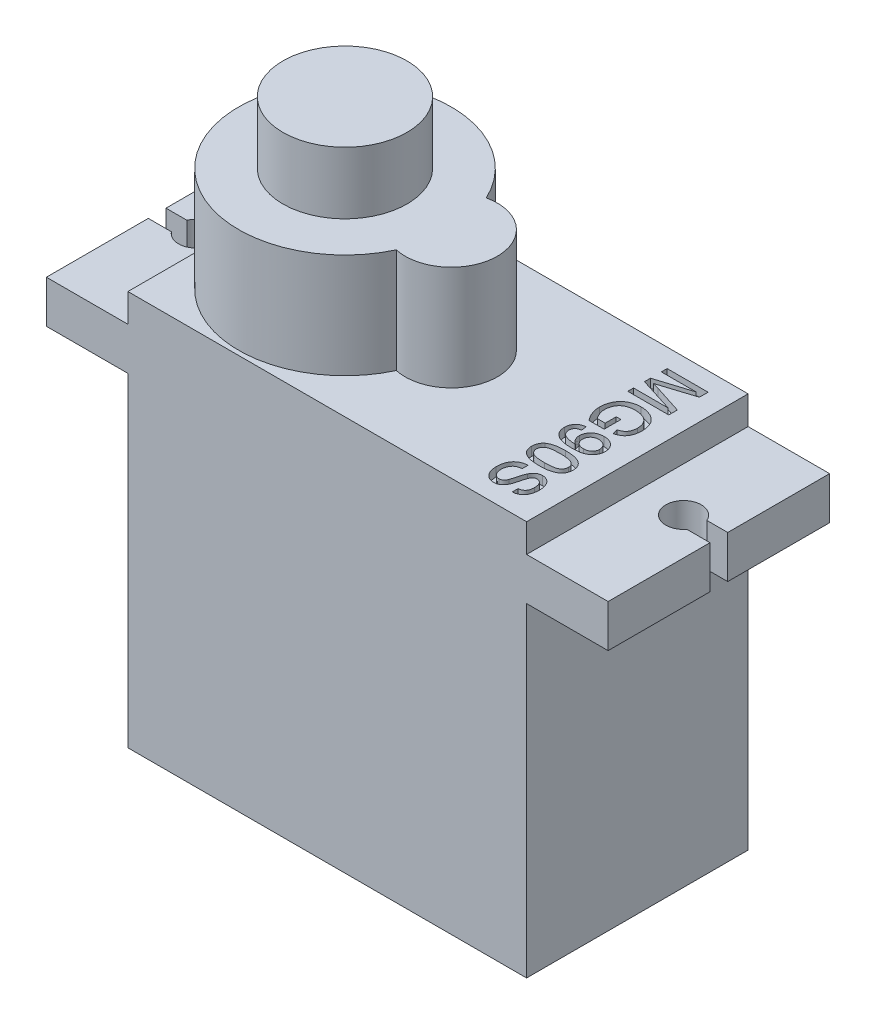
from build123d import *

# Parameters (mm, degrees)
SKETCH_1_W          = 22.5
SKETCH_1_H          = 12.5
EXTRUDE_1_DEPTH     = 22.3
EXTRUDE_2_DEPTH     = 5.9
SKETCH_3_R          = 3.5
EXTRUDE_3_DEPTH     = 3.5
EXTRUDE_4_DEPTH     = 2.4
EXTRUDE_5_DEPTH     = 3
CUT_EXTRUDE_1_DEPTH = 0.5


with BuildPart() as part:
    # 草图1 → 凸台-拉伸1 (new body)
    with BuildSketch(Plane(origin=(0, 0, 0), x_dir=(1, 0, 0), z_dir=(0, 1, 0))):
        with Locations((5.25, 0)):
            Rectangle(SKETCH_1_W, SKETCH_1_H)
    extrude(amount=EXTRUDE_1_DEPTH)

    # 草图2 → 凸台-拉伸2 (add)
    with BuildSketch(Plane(origin=(0, 22.3, 0), x_dir=(1, 0, 0), z_dir=(0, 1, 0))):
        with BuildLine():
            ThreePointArc((5.436666667, -2.538238672), (8.6, 0), (5.436666667, 2.538238672))
            ThreePointArc((5.436666667, 2.538238672), (-6, 0), (5.436666667, -2.538238672))
        make_face()
    extrude(amount=EXTRUDE_2_DEPTH)

    # 草图3 → 凸台-拉伸3 (add)
    with BuildSketch(Plane(origin=(0, 28.2, 0), x_dir=(1, 0, 0), z_dir=(0, 1, 0))):
        Circle(SKETCH_3_R)
    extrude(amount=EXTRUDE_3_DEPTH)

    # 草图4 → 凸台-拉伸4 (add)
    with BuildSketch(Plane(origin=(0, 20.7, 0), x_dir=(1, 0, 0), z_dir=(0, 1, 0))):
        with BuildLine():
            Line((16.5, 6.25), (16.5, -6.25))
            Line((16.5, -6.25), (21.1, -6.25))
            Line((21.1, -6.25), (21.1, -0.5))
            Line((21.1, -0.5), (19.793874497, -0.5))
            ThreePointArc((19.793874497, -0.5), (18.007860167, 0.233215776), (19.92, 0.5))
            Line((19.92, 0.5), (21.1, 0.5))
            Line((21.1, 0.5), (21.1, 6.25))
            Line((21.1, 6.25), (16.5, 6.25))
        make_face()
    extrude_4 = extrude(amount=-EXTRUDE_4_DEPTH)

    # 镜向1: 凸台-拉伸4 across plane
    add(extrude_4.mirror(Plane(origin=(5.25, 0, 0), x_dir=(0, 0, 1), z_dir=(1, 0, 0))))

    # 草图5 → 凸台-拉伸5 (add)
    with BuildSketch(Plane.ZY.offset(6)):
        with BuildLine():
            Line((-0.95, 5.3), (0.95, 5.3))
            ThreePointArc((0.95, 5.3), (1.55, 4.7), (0.95, 4.1))
            Line((0.95, 4.1), (-0.95, 4.1))
            ThreePointArc((-0.95, 4.1), (-1.55, 4.7), (-0.95, 5.3))
        make_face()
    extrude(amount=EXTRUDE_5_DEPTH)

    # 草图6 → 切除-拉伸1 (cut)
    # profile 1 of 5: a face of its own
    with BuildSketch(Plane(origin=(0, 22.3, 0), x_dir=(1, 0, 0), z_dir=(0, 1, 0))):
        with BuildLine():
            Line((12.98065719, 5.200845337), (15.292144006, 5.200845337))
            Line((15.292144006, 5.200845337), (15.292144006, 4.710487857))
            Line((15.292144006, 4.710487857), (13.670121106, 4.193737199))
            add(Edge.make_bspline(
                [(13.670121106, 4.193737199), (13.651746413, 4.188050336), (13.616210827, 4.177052274), (13.564894171, 4.160743453), (13.517206842, 4.14590516), (13.472997048, 4.13254094), (13.43248429, 4.119928954), (13.39533613, 4.109008961), (13.361965366, 4.098569092), (13.340757155, 4.092450863), (13.330714087, 4.089553598)],
                knots=[0, 0, 0, 0, 1.300204174, 2.514519184, 3.639827924, 4.676153899, 5.636536826, 6.507959918, 7.293450077, 8, 8, 8, 8], degree=3))
            add(Edge.make_bspline(
                [(13.330714087, 4.089553598), (13.341676974, 4.086326718), (13.365006699, 4.079459712), (13.401688691, 4.068327197), (13.442281443, 4.056481884), (13.486087232, 4.042306675), (13.533793233, 4.027530697), (13.585359828, 4.012021385), (13.640272186, 3.994131696), (13.678288855, 3.982243104), (13.697903399, 3.976109233)],
                knots=[0, 0, 0, 0, 0.713638162, 1.518667645, 2.393860736, 3.354087503, 4.393659122, 5.512594909, 6.716633584, 8, 8, 8, 8], degree=3))
            Line((13.697903399, 3.976109233), (15.292144006, 3.464451995))
            Line((15.292144006, 3.464451995), (15.292144006, 2.97826186))
            Line((15.292144006, 2.97826186), (12.98065719, 2.97826186))
            Line((12.98065719, 2.97826186), (12.98065719, 3.30424077))
            Line((12.98065719, 3.30424077), (14.93653065, 3.30424077))
            Line((14.93653065, 3.30424077), (12.98065719, 3.921007685))
            Line((12.98065719, 3.921007685), (12.98065719, 4.261803818))
            Line((12.98065719, 4.261803818), (14.93653065, 4.874866427))
            Line((14.93653065, 4.874866427), (12.98065719, 4.874866427))
            Line((12.98065719, 4.874866427), (12.98065719, 5.200845337))
        make_face()
    # profile 2 of 5: a face of its own
    with BuildSketch(Plane(origin=(0, 22.3, 0), x_dir=(1, 0, 0), z_dir=(0, 1, 0))):
        with BuildLine():
            Line((13.899325027, 1.407636202), (14.166035044, 1.407636202))
            Line((14.166035044, 1.407636202), (14.166035044, 0.459333919))
            Line((14.166035044, 0.459333919), (13.310803444, 0.459333919))
            add(Edge.make_bspline(
                [(13.310803444, 0.459333919), (13.282308288, 0.496749863), (13.226226287, 0.570389084), (13.1530637, 0.68586653), (13.091169318, 0.803153126), (13.039734731, 0.921850938), (13.000243456, 1.042812334), (12.972073135, 1.165376409), (12.954086368, 1.289491289), (12.952044853, 1.372848141), (12.951022743, 1.414581776)],
                knots=[0, 0, 0, 0, 1.084304515, 2.13404583, 3.148352623, 4.140192615, 5.113911073, 6.078424675, 7.037939656, 8, 8, 8, 8], degree=3))
            add(Edge.make_bspline(
                [(12.951022743, 1.414581776), (12.951451743, 1.44253427), (12.952303967, 1.498062871), (12.959597773, 1.580275232), (12.97042817, 1.66057008), (12.98637981, 1.738785068), (13.006558012, 1.81509181), (13.031818959, 1.889355259), (13.060963192, 1.961805462), (13.094487732, 2.032073127), (13.13307654, 2.098998186), (13.174906802, 2.162678244), (13.221548864, 2.221687218), (13.271952524, 2.276409681), (13.326647042, 2.326648934), (13.384865782, 2.373176359), (13.447686718, 2.414734918), (13.513949538, 2.452251802), (13.583160827, 2.485357128), (13.65470255, 2.514345394), (13.728543378, 2.53801079), (13.803904729, 2.558904612), (13.881541473, 2.573788254), (13.960941401, 2.585124231), (14.042451231, 2.591571375), (14.097494767, 2.592530015), (14.12528768, 2.593014057)],
                knots=[0, 0, 0, 0, 1.072785209, 2.131125078, 3.165919489, 4.18145346, 5.19319543, 6.193685685, 7.190467576, 8.189500733, 9.179374003, 10.153807477, 11.111508507, 12.063253261, 13.006625817, 13.959678989, 14.920965282, 15.894678021, 16.880464779, 17.86404133, 18.855172685, 19.855469953, 20.864032331, 21.887090983, 22.933137249, 24, 24, 24, 24], degree=3))
            add(Edge.make_bspline(
                [(14.12528768, 2.593014057), (14.152927052, 2.592532653), (14.207817779, 2.591576604), (14.289617686, 2.585016495), (14.369967584, 2.573845953), (14.44903455, 2.55869657), (14.526402048, 2.538566889), (14.602575856, 2.514636418), (14.677125996, 2.485703098), (14.750073903, 2.453083991), (14.820060257, 2.416501846), (14.885807322, 2.375439465), (14.946963081, 2.330737322), (15.003178339, 2.281645362), (15.055423239, 2.229498994), (15.102148366, 2.172635607), (15.144462351, 2.112289334), (15.181970348, 2.048271849), (15.214700717, 1.980940181), (15.243527387, 1.911103104), (15.267447929, 1.838600676), (15.287629303, 1.76384885), (15.302624365, 1.686433312), (15.313904306, 1.606553632), (15.320347074, 1.524119548), (15.321297368, 1.468304911), (15.321778452, 1.440048878)],
                knots=[0, 0, 0, 0, 1.060071961, 2.105262061, 3.145073557, 4.17023897, 5.191105187, 6.20959997, 7.230929519, 8.256368373, 9.273210202, 10.257139963, 11.226862678, 12.175263777, 13.117120328, 14.054725526, 14.994123112, 15.941396515, 16.897159372, 17.863479033, 18.836934967, 19.823443608, 20.831180499, 21.85926455, 22.916257547, 24, 24, 24, 24], degree=3))
            add(Edge.make_bspline(
                [(15.321778452, 1.440048878), (15.320777562, 1.399415571), (15.318814559, 1.319723214), (15.304094315, 1.203158328), (15.27828018, 1.092720426), (15.243738642, 0.988810795), (15.199233986, 0.893666773), (15.147688515, 0.80765329), (15.086316611, 0.733632035), (15.01725295, 0.66930728), (14.93814756, 0.614984794), (14.848879086, 0.568408008), (14.749058465, 0.527835908), (14.677614026, 0.507713982), (14.640649224, 0.497303053)],
                knots=[0, 0, 0, 0, 1.150676663, 2.256772653, 3.320320098, 4.358473249, 5.351958892, 6.289850531, 7.190417357, 8.06583901, 8.954691151, 9.89917112, 10.913047355, 12, 12, 12, 12], degree=3))
            Line((14.640649224, 0.497303053), (14.565637032, 0.79549967))
            add(Edge.make_bspline(
                [(14.565637032, 0.79549967), (14.593076659, 0.804091627), (14.645629662, 0.820547141), (14.718889664, 0.849746665), (14.782573489, 0.882896399), (14.83821226, 0.919198801), (14.886449676, 0.962229198), (14.928495721, 1.01264413), (14.965924735, 1.070752427), (14.997342274, 1.136348225), (15.023308409, 1.207777431), (15.04155356, 1.283893589), (15.05308269, 1.363758259), (15.054397205, 1.418245535), (15.055068435, 1.446068375)],
                knots=[0, 0, 0, 0, 1.164623905, 2.230514369, 3.189783183, 4.069010262, 4.914877457, 5.797920336, 6.720606112, 7.707754307, 8.738229757, 9.793726076, 10.873410273, 12, 12, 12, 12], degree=3))
            add(Edge.make_bspline(
                [(15.055068435, 1.446068375), (15.054234402, 1.478976602), (15.052619613, 1.542690966), (15.041184182, 1.634890578), (15.021388159, 1.720141847), (14.99351882, 1.798298792), (14.958939666, 1.869117281), (14.920329636, 1.933727749), (14.875624551, 1.990475982), (14.826042739, 2.03982059), (14.772973173, 2.082718942), (14.717663333, 2.120976508), (14.659657967, 2.154245416), (14.61891006, 2.172015039), (14.598512746, 2.180910037)],
                knots=[0, 0, 0, 0, 1.282165913, 2.482430477, 3.613002584, 4.685891271, 5.708038531, 6.679660972, 7.613314633, 8.514881922, 9.39970426, 10.268853837, 11.133434455, 12, 12, 12, 12], degree=3))
            add(Edge.make_bspline(
                [(14.598512746, 2.180910037), (14.562623972, 2.194131154), (14.490352322, 2.220755411), (14.376736152, 2.247818181), (14.258481573, 2.263706387), (14.178123671, 2.26591424), (14.137326674, 2.267035147)],
                knots=[0, 0, 0, 0, 0.971838637, 1.957057173, 2.962815955, 4, 4, 4, 4], degree=3))
            add(Edge.make_bspline(
                [(14.137326674, 2.267035147), (14.112310396, 2.266875972), (14.063302703, 2.266564145), (13.991347982, 2.260953577), (13.922313653, 2.253647818), (13.856579706, 2.241676813), (13.793760485, 2.227802818), (13.73443602, 2.209287049), (13.677675361, 2.188895957), (13.624493524, 2.164095763), (13.574345703, 2.136784378), (13.527316825, 2.106832646), (13.484190394, 2.073215858), (13.44406056, 2.036881378), (13.407061372, 1.99767421), (13.373567994, 1.955395975), (13.343818889, 1.90998775), (13.308337644, 1.846333902), (13.272648029, 1.762505799), (13.240523838, 1.658661839), (13.221644335, 1.551245094), (13.21904391, 1.478552874), (13.21773276, 1.441901031)],
                knots=[0, 0, 0, 0, 1.07090929, 2.097945639, 3.089137996, 4.042109723, 4.957603585, 5.842006935, 6.701460028, 7.538380432, 8.351768609, 9.145614463, 9.922973058, 10.69034897, 11.461841051, 12.228789892, 12.996877062, 13.783925265, 15.346951304, 16.887853154, 18.430837314, 20, 20, 20, 20], degree=3))
            add(Edge.make_bspline(
                [(13.21773276, 1.441901031), (13.218787535, 1.409747351), (13.220892221, 1.345588186), (13.235617503, 1.249934896), (13.260362787, 1.155733742), (13.29391381, 1.064798693), (13.332617563, 0.980031071), (13.373711249, 0.904859069), (13.414861505, 0.839507655), (13.446358148, 0.802743094), (13.461290866, 0.785312829)],
                knots=[0, 0, 0, 0, 1.080743358, 2.156505587, 3.245104578, 4.349795648, 5.410880174, 6.374485899, 7.229335469, 8, 8, 8, 8], degree=3))
            Line((13.461290866, 0.785312829), (13.899325027, 0.785312829))
            Line((13.899325027, 0.785312829), (13.899325027, 1.407636202))
        make_face()
    # profile 3 of 5: a face of its own
    with BuildSketch(Plane(origin=(0, 22.3, 0), x_dir=(1, 0, 0), z_dir=(0, 1, 0))):
        with BuildLine():
            Line((13.54371167, 0.074086116), (13.573346117, -0.222258348))
            add(Edge.make_bspline(
                [(13.573346117, -0.222258348), (13.558162593, -0.224937479), (13.528811553, -0.230116466), (13.486981292, -0.241803807), (13.447978625, -0.253657638), (13.412672436, -0.268959337), (13.380103714, -0.284894941), (13.350598822, -0.302941575), (13.324750356, -0.32342077), (13.294460561, -0.352340083), (13.262852645, -0.393372377), (13.237249002, -0.450248697), (13.220033865, -0.512817992), (13.218517328, -0.556912116), (13.21773276, -0.579723857)],
                knots=[0, 0, 0, 0, 0.994516507, 1.922484754, 2.80151264, 3.623050913, 4.402748861, 5.140924173, 5.850441436, 6.526872911, 7.841975818, 9.161260782, 10.53140107, 12, 12, 12, 12], degree=3))
            add(Edge.make_bspline(
                [(13.21773276, -0.579723857), (13.218453086, -0.599683705), (13.2198708, -0.638967781), (13.230815813, -0.696256356), (13.248508071, -0.750826321), (13.273504098, -0.801782802), (13.304122116, -0.848680603), (13.34105338, -0.889052363), (13.381203221, -0.925071344), (13.428257159, -0.954136337), (13.48173356, -0.97900415), (13.542475727, -1.002693982), (13.611980643, -1.023980784), (13.688367697, -1.044889397), (13.770048499, -1.061542779), (13.854246717, -1.074239485), (13.939777606, -1.081803581), (13.997320053, -1.082631113), (14.0261975, -1.083046407)],
                knots=[0, 0, 0, 0, 0.897578202, 1.76657305, 2.614273066, 3.471505887, 4.31321098, 5.12466348, 5.926910931, 6.732248404, 7.601992158, 8.57824993, 9.663257946, 10.871084486, 12.140451753, 13.411337856, 14.700890224, 16, 16, 16, 16], degree=3))
            add(Edge.make_bspline(
                [(14.0261975, -1.083046407), (14.034069486, -1.082906135), (14.052902752, -1.082570544), (14.071730244, -1.081993274), (14.082688164, -1.081657292)],
                knots=[0, 0, 0, 0, 0.835966126, 2, 2, 2, 2], degree=3))
            add(Edge.make_bspline(
                [(14.082688164, -1.081657292), (14.060994883, -1.067369971), (14.017643276, -1.03881835), (13.959433625, -0.986238399), (13.907991805, -0.926106114), (13.86307256, -0.85962447), (13.826475731, -0.787717016), (13.800031038, -0.711905493), (13.783498493, -0.633069527), (13.781697811, -0.579495793), (13.780787241, -0.552404602)],
                knots=[0, 0, 0, 0, 0.978759816, 1.95594251, 2.946784326, 3.957659885, 4.975752972, 5.981130809, 6.979097274, 8, 8, 8, 8], degree=3))
            add(Edge.make_bspline(
                [(13.780787241, -0.552404602), (13.781371992, -0.529829595), (13.782523084, -0.485390261), (13.792758108, -0.420296053), (13.808096576, -0.357682016), (13.831358389, -0.298170611), (13.859932218, -0.240842751), (13.895505542, -0.186579979), (13.937049223, -0.134625257), (13.985009615, -0.086144919), (14.037686451, -0.04110833), (14.095694089, -0.002788363), (14.157046402, 0.03049314), (14.222747078, 0.057329682), (14.292537015, 0.078244617), (14.366524524, 0.092718418), (14.444370001, 0.102469041), (14.497693763, 0.103297855), (14.524889668, 0.103720562)],
                knots=[0, 0, 0, 0, 0.975605932, 1.920499032, 2.843232031, 3.758037144, 4.677408539, 5.60862402, 6.558243673, 7.549410996, 8.553572665, 9.549515321, 10.549921107, 11.567546087, 12.612813693, 13.695349167, 14.824594087, 16, 16, 16, 16], degree=3))
            add(Edge.make_bspline(
                [(14.524889668, 0.103720562), (14.553006183, 0.103085907), (14.608006963, 0.101844412), (14.688432283, 0.092496342), (14.764597631, 0.076954564), (14.836542331, 0.054532498), (14.904207789, 0.025895777), (14.96781443, -0.009187842), (15.027185973, -0.050361686), (15.081614449, -0.097740544), (15.131182754, -0.149300319), (15.174283086, -0.204901428), (15.210744676, -0.263728907), (15.240545524, -0.325662274), (15.263761254, -0.390864527), (15.280504938, -0.459251018), (15.29033823, -0.530971471), (15.291534865, -0.579847714), (15.292144006, -0.604727921)],
                knots=[0, 0, 0, 0, 1.151853335, 2.253224889, 3.312446237, 4.332583134, 5.335719854, 6.317925586, 7.303870435, 8.290281678, 9.269877867, 10.230009666, 11.167185276, 12.100619225, 13.040777443, 13.997905303, 14.980843721, 16, 16, 16, 16], degree=3))
            add(Edge.make_bspline(
                [(15.292144006, -0.604727921), (15.291778435, -0.62279798), (15.291051803, -0.658715215), (15.285507458, -0.712168346), (15.275503966, -0.764352446), (15.262906496, -0.8156232), (15.245259531, -0.86519296), (15.225247484, -0.914088434), (15.200294822, -0.961367038), (15.172348867, -1.007437951), (15.140754918, -1.051663013), (15.105734075, -1.093145109), (15.06730906, -1.131781291), (15.026270796, -1.168251487), (14.980956734, -1.200749954), (14.933280962, -1.231629633), (14.882139571, -1.259342806), (14.827480804, -1.284618632), (14.768174628, -1.307114173), (14.702911834, -1.325881346), (14.63146597, -1.341968923), (14.553742458, -1.355363439), (14.469796671, -1.365295686), (14.379753379, -1.372605241), (14.28354409, -1.377390493), (14.21728391, -1.377793997), (14.183167458, -1.378001756)],
                knots=[0, 0, 0, 0, 0.850649219, 1.690806217, 2.525952199, 3.350728827, 4.173390229, 5.000627785, 5.835868593, 6.687014215, 7.535923736, 8.391863363, 9.239652622, 10.09956172, 10.973025521, 11.861918239, 12.77237812, 13.70871133, 14.695238383, 15.755241161, 16.902781388, 18.141566996, 19.466439711, 20.880880435, 22.394008392, 24, 24, 24, 24], degree=3))
            add(Edge.make_bspline(
                [(14.183167458, -1.378001756), (14.147507788, -1.377792607), (14.078008525, -1.377384983), (13.976557238, -1.372562164), (13.880655488, -1.365256284), (13.790240293, -1.355317017), (13.705449646, -1.341829131), (13.626298378, -1.325797701), (13.552640335, -1.306891381), (13.48446914, -1.284673635), (13.421001059, -1.259416579), (13.361455658, -1.231741507), (13.305917156, -1.200749821), (13.254292729, -1.16677704), (13.206443098, -1.130304909), (13.162756782, -1.090674497), (13.122620572, -1.048414939), (13.086652333, -1.003088152), (13.054552084, -0.955262234), (13.026864125, -0.90537432), (13.003302341, -0.853387945), (12.984759479, -0.799291283), (12.969008056, -0.743456938), (12.958518467, -0.685474589), (12.952553928, -0.625536287), (12.951537574, -0.584984828), (12.951022743, -0.564443596)],
                knots=[0, 0, 0, 0, 1.53828126, 2.998048286, 4.380503188, 5.687180253, 6.920921401, 8.083158855, 9.170072423, 10.199756934, 11.174108674, 12.115409324, 13.030557948, 13.915183547, 14.779528501, 15.623394403, 16.457111345, 17.291120731, 18.116634045, 18.939295836, 19.749931863, 20.575445177, 21.404148037, 22.250453583, 23.113771998, 24, 24, 24, 24], degree=3))
            add(Edge.make_bspline(
                [(12.951022743, -0.564443596), (12.951400039, -0.542656494), (12.952138219, -0.50002994), (12.959879824, -0.437795303), (12.971691859, -0.37852461), (12.988936436, -0.322452484), (13.010714265, -0.26915462), (13.037709246, -0.219135921), (13.069242909, -0.17191734), (13.106156287, -0.128580132), (13.146569095, -0.087994367), (13.192078082, -0.05251452), (13.2406486, -0.02006331), (13.293937227, 0.006875758), (13.350512666, 0.030935256), (13.41143658, 0.049529079), (13.47608338, 0.064651917), (13.52080488, 0.070890601), (13.54371167, 0.074086116)],
                knots=[0, 0, 0, 0, 1.082094624, 2.117122533, 3.111365433, 4.081805917, 5.027534362, 5.967742126, 6.901578079, 7.843317407, 8.792398629, 9.74225427, 10.705882, 11.69037427, 12.704533291, 13.757311142, 14.851272765, 16, 16, 16, 16], degree=3))
        make_face()
        with BuildLine():
            add(Edge.make_bspline(
                [(14.531372203, -1.081657292), (14.549909064, -1.081325476), (14.585989873, -1.080679618), (14.638620889, -1.074975424), (14.688222543, -1.065902845), (14.734848155, -1.052827599), (14.778755358, -1.036306181), (14.819442607, -1.015167357), (14.857744095, -0.991273433), (14.892464044, -0.963229345), (14.923940774, -0.932594251), (14.950861199, -0.898742087), (14.974396265, -0.863205313), (14.992733099, -0.824696379), (15.007874811, -0.784526578), (15.017763425, -0.741691422), (15.024692744, -0.696791049), (15.025183576, -0.665877242), (15.025433989, -0.650105667)],
                knots=[0, 0, 0, 0, 1.203367657, 2.342277964, 3.433257985, 4.474054639, 5.482897531, 6.473503642, 7.44666697, 8.4092964, 9.366064381, 10.292698324, 11.212859648, 12.127271788, 13.056341611, 13.99466363, 14.976919499, 16, 16, 16, 16], degree=3))
            add(Edge.make_bspline(
                [(15.025433989, -0.650105667), (15.024942403, -0.633883189), (15.023973979, -0.601924865), (15.017737285, -0.555083585), (15.005795936, -0.510660402), (14.989956008, -0.468355409), (14.970362296, -0.427698749), (14.944688544, -0.390168451), (14.91559382, -0.354192615), (14.881840065, -0.321214177), (14.84483272, -0.291089461), (14.80491914, -0.264546267), (14.762079768, -0.242193534), (14.716493216, -0.224325312), (14.668556818, -0.209722845), (14.617841949, -0.199691988), (14.564402599, -0.193519859), (14.527839627, -0.192927005), (14.509146368, -0.192623901)],
                knots=[0, 0, 0, 0, 1.007165334, 1.984118292, 2.925321257, 3.856078893, 4.785899085, 5.718627206, 6.671847665, 7.654235469, 8.641842333, 9.630378272, 10.624608936, 11.635186472, 12.665777387, 13.731187195, 14.840042241, 16, 16, 16, 16], degree=3))
            add(Edge.make_bspline(
                [(14.509146368, -0.192623901), (14.492462657, -0.192974151), (14.459770982, -0.193660464), (14.411850596, -0.199204977), (14.366442666, -0.208905739), (14.323387173, -0.222511205), (14.282661632, -0.239494712), (14.244240111, -0.260487981), (14.20855706, -0.285710951), (14.175253285, -0.31428061), (14.145254011, -0.346070655), (14.119067053, -0.380720626), (14.096660804, -0.417876548), (14.078624319, -0.457861373), (14.064734268, -0.500441302), (14.054508202, -0.545519654), (14.048417348, -0.593292827), (14.047808036, -0.626009884), (14.047497259, -0.642697056)],
                knots=[0, 0, 0, 0, 1.102084814, 2.159531352, 3.181572939, 4.165248282, 5.138722115, 6.092556128, 7.051608923, 8.020532162, 8.987198964, 9.9335355, 10.884913354, 11.847861675, 12.824960724, 13.839240115, 14.897915186, 16, 16, 16, 16], degree=3))
            add(Edge.make_bspline(
                [(14.047497259, -0.642697056), (14.047811072, -0.658304962), (14.048428726, -0.689024813), (14.054545559, -0.734026167), (14.064790538, -0.776785913), (14.078719018, -0.817496036), (14.096748602, -0.856090553), (14.119335371, -0.892309939), (14.145214074, -0.926854341), (14.175452075, -0.958711129), (14.208931455, -0.987827068), (14.245982962, -1.013006941), (14.285933729, -1.034509202), (14.329257306, -1.051433669), (14.375420302, -1.064989365), (14.424714983, -1.074533476), (14.477036119, -1.080783746), (14.512986246, -1.081361706), (14.531372203, -1.081657292)],
                knots=[0, 0, 0, 0, 1.017004716, 2.00169281, 2.953445817, 3.879374072, 4.80207141, 5.723561102, 6.657273834, 7.611045633, 8.581233951, 9.544037932, 10.525327521, 11.53237926, 12.57032081, 13.657564536, 14.802009319, 16, 16, 16, 16], degree=3))
        make_face(mode=Mode.SUBTRACT)
    # profile 4 of 5: a face of its own
    with BuildSketch(Plane(origin=(0, 22.3, 0), x_dir=(1, 0, 0), z_dir=(0, 1, 0))):
        with BuildLine():
            add(Edge.make_bspline(
                [(14.120657298, -1.67434622), (14.153690566, -1.674644787), (14.218388828, -1.675229555), (14.31305401, -1.678856673), (14.402953605, -1.685189343), (14.488009576, -1.694642226), (14.568413788, -1.705836372), (14.64405192, -1.72038826), (14.715092216, -1.736763149), (14.781465665, -1.756403418), (14.843725486, -1.77800423), (14.901832529, -1.802431691), (14.955443083, -1.830157443), (15.006013056, -1.858681346), (15.05117362, -1.891890466), (15.093785231, -1.925568509), (15.131415537, -1.963159914), (15.165296253, -2.002876808), (15.195184584, -2.045377427), (15.220977065, -2.090417659), (15.243749292, -2.137829318), (15.260892382, -2.188514632), (15.274867586, -2.241421759), (15.285147928, -2.296957847), (15.291208534, -2.355184124), (15.291828659, -2.394973598), (15.292144006, -2.415207379)],
                knots=[0, 0, 0, 0, 1.514715004, 2.966688829, 4.343277319, 5.646155648, 6.890271291, 8.064567311, 9.176982507, 10.231801866, 11.236819303, 12.197732759, 13.118802951, 14.00370591, 14.856056722, 15.686168072, 16.491905873, 17.290274347, 18.077650358, 18.870352107, 19.668187111, 20.485160842, 21.319455353, 22.17593919, 23.072426909, 24, 24, 24, 24], degree=3))
            add(Edge.make_bspline(
                [(15.292144006, -2.415207379), (15.29127049, -2.444892435), (15.289554434, -2.503209919), (15.275582155, -2.588362805), (15.251621303, -2.66857944), (15.219549362, -2.743847273), (15.178061774, -2.812538788), (15.128924569, -2.874642305), (15.070080475, -2.927648574), (15.003460567, -2.97330853), (14.928932595, -3.01246194), (14.847198403, -3.047486271), (14.757911518, -3.078888844), (14.67821366, -3.101874163), (14.609299104, -3.117988906), (14.552352859, -3.127800016), (14.49109618, -3.136858512), (14.425382372, -3.143279298), (14.355518569, -3.14981297), (14.28120013, -3.153038723), (14.202477523, -3.155500449), (14.148441995, -3.155875625), (14.120657298, -3.156068538)],
                knots=[0, 0, 0, 0, 1.134508601, 2.228787654, 3.287419779, 4.328790846, 5.347871456, 6.346850563, 7.345149742, 8.363256079, 9.427154287, 10.558404831, 11.760335901, 13.043439251, 13.7276639, 14.464993199, 15.251939769, 16.09452972, 16.988861801, 17.934185368, 18.937772297, 20, 20, 20, 20], degree=3))
            add(Edge.make_bspline(
                [(14.120657298, -3.156068538), (14.087778932, -3.155766062), (14.023544573, -3.155175115), (13.929642054, -3.151621799), (13.840408008, -3.144989869), (13.755733616, -3.136443656), (13.675540357, -3.124937263), (13.60002449, -3.110555597), (13.529093394, -3.093944747), (13.462675528, -3.075147298), (13.400679488, -3.053277831), (13.342808573, -3.028611961), (13.288495731, -3.002162863), (13.238752497, -2.972162399), (13.192755427, -2.940210123), (13.150359721, -2.906007514), (13.112167932, -2.868846128), (13.078398528, -2.828758506), (13.047972727, -2.786561283), (13.021945718, -2.741404003), (13.000232665, -2.693392308), (12.98208514, -2.6429541), (12.968293393, -2.589754595), (12.95805339, -2.534070987), (12.951937154, -2.475539994), (12.951331752, -2.43559572), (12.951022743, -2.415207379)],
                knots=[0, 0, 0, 0, 1.50892112, 2.947974422, 4.311604492, 5.614840882, 6.853004102, 8.028299315, 9.14166105, 10.195403725, 11.194594867, 12.156325951, 13.08133133, 13.964490992, 14.819271038, 15.650088719, 16.461567135, 17.260614929, 18.05275699, 18.846133239, 19.648095618, 20.468123593, 21.303127994, 22.167306962, 23.06455749, 24, 24, 24, 24], degree=3))
            add(Edge.make_bspline(
                [(12.951022743, -2.415207379), (12.951785243, -2.388476499), (12.953271908, -2.336358641), (12.963372878, -2.260244352), (12.981151061, -2.188807032), (13.00499411, -2.121444148), (13.036885562, -2.058912878), (13.075687741, -2.000914658), (13.120497873, -1.946284058), (13.155852038, -1.914835363), (13.173744129, -1.898919758)],
                knots=[0, 0, 0, 0, 1.10322584, 2.150986741, 3.161425019, 4.136713905, 5.093944212, 6.049774532, 7.013026876, 8, 8, 8, 8], degree=3))
            add(Edge.make_bspline(
                [(13.173744129, -1.898919758), (13.200169882, -1.880600532), (13.254660916, -1.842825503), (13.347573184, -1.798613106), (13.449856545, -1.759174866), (13.563517788, -1.728223078), (13.687652297, -1.703980112), (13.82250365, -1.686470638), (13.968013589, -1.676562), (14.068627447, -1.675101486), (14.120657298, -1.67434622)],
                knots=[0, 0, 0, 0, 0.779365345, 1.607084704, 2.489375761, 3.438383567, 4.461919411, 5.557722155, 6.737039282, 8, 8, 8, 8], degree=3))
        make_face()
        with BuildLine():
            add(Edge.make_bspline(
                [(14.121583375, -1.970690683), (14.077125076, -1.97098493), (13.992022058, -1.971548183), (13.870437714, -1.977432808), (13.76075204, -1.987562948), (13.663116902, -2.000955655), (13.577400229, -2.01863945), (13.503820454, -2.040843547), (13.441494454, -2.065872845), (13.39119471, -2.096846127), (13.35019308, -2.13075845), (13.314930353, -2.165770606), (13.284957843, -2.202706309), (13.259966882, -2.24132456), (13.241045368, -2.282224547), (13.227331012, -2.324959037), (13.219438611, -2.369537327), (13.218304622, -2.399897169), (13.21773276, -2.415207379)],
                knots=[0, 0, 0, 0, 1.89448813, 3.626469325, 5.185477471, 6.587276848, 7.82441448, 8.910550357, 9.859733512, 10.6775885, 11.416198291, 12.123144072, 12.791880183, 13.439617036, 14.078171869, 14.70637855, 15.347637704, 16, 16, 16, 16], degree=3))
            add(Edge.make_bspline(
                [(13.21773276, -2.415207379), (13.218317117, -2.430513755), (13.219475884, -2.460865994), (13.22719425, -2.505547286), (13.241614611, -2.548115506), (13.260469295, -2.588954512), (13.284890637, -2.627853451), (13.31497636, -2.664607752), (13.350218149, -2.699804345), (13.391696348, -2.733564335), (13.442228644, -2.764301644), (13.504503874, -2.789800461), (13.578212509, -2.811658519), (13.663885509, -2.829439349), (13.761366279, -2.842887303), (13.870747735, -2.852956195), (13.992175639, -2.858880201), (14.077124875, -2.859434159), (14.121583375, -2.859724074)],
                knots=[0, 0, 0, 0, 0.652509534, 1.29391342, 1.924290653, 2.562989607, 3.207355802, 3.876242846, 4.583348185, 5.32723334, 6.150888545, 7.094226006, 8.186903555, 9.424320409, 10.81992305, 12.379283064, 14.105084285, 16, 16, 16, 16], degree=3))
            add(Edge.make_bspline(
                [(14.121583375, -2.859724074), (14.16511684, -2.859443445), (14.248525313, -2.858905769), (14.367767284, -2.852828928), (14.475612083, -2.843306198), (14.572158286, -2.830279915), (14.657303765, -2.812970188), (14.731221406, -2.791969194), (14.793779373, -2.766963753), (14.845526382, -2.73716959), (14.888241828, -2.704134781), (14.924494712, -2.669036142), (14.956264331, -2.632552908), (14.981140598, -2.59260021), (15.001542724, -2.550876501), (15.015200571, -2.506487355), (15.023966072, -2.460005931), (15.024937527, -2.428213597), (15.025433989, -2.411966111)],
                knots=[0, 0, 0, 0, 1.850145643, 3.544809038, 5.072983816, 6.450691362, 7.683229814, 8.76276662, 9.712991103, 10.538891656, 11.292051756, 12.001912283, 12.681449089, 13.342071824, 13.996410874, 14.649960216, 15.310061595, 16, 16, 16, 16], degree=3))
            add(Edge.make_bspline(
                [(15.025433989, -2.411966111), (15.025032181, -2.396656863), (15.024239869, -2.366468987), (15.016677253, -2.322269983), (15.004030874, -2.280383106), (14.986900126, -2.240328469), (14.963845523, -2.203106013), (14.936927633, -2.167239588), (14.904131188, -2.134409039), (14.879613078, -2.114625639), (14.867074916, -2.10450873)],
                knots=[0, 0, 0, 0, 1.021318143, 2.013908504, 2.982026795, 3.937174072, 4.91255697, 5.897578595, 6.924855925, 8, 8, 8, 8], degree=3))
            add(Edge.make_bspline(
                [(14.867074916, -2.10450873), (14.848660239, -2.093494503), (14.809772319, -2.070234774), (14.742183512, -2.044208489), (14.664942371, -2.021217898), (14.576860485, -2.00228902), (14.478088949, -1.988595304), (14.368742469, -1.977784645), (14.248668382, -1.97216891), (14.165113816, -1.97119702), (14.121583375, -1.970690683)],
                knots=[0, 0, 0, 0, 0.671104906, 1.417232262, 2.260109084, 3.195198885, 4.23592645, 5.382417421, 6.636286093, 8, 8, 8, 8], degree=3))
        make_face(mode=Mode.SUBTRACT)
    # profile 5 of 5: a face of its own
    with BuildSketch(Plane(origin=(0, 22.3, 0), x_dir=(1, 0, 0), z_dir=(0, 1, 0))):
        with BuildLine():
            Line((13.780787241, -3.452413001), (13.780787241, -3.778391911))
            add(Edge.make_bspline(
                [(13.780787241, -3.778391911), (13.751516054, -3.781972352), (13.695284526, -3.78885057), (13.615628873, -3.808178299), (13.543788342, -3.832758568), (13.479670628, -3.864430033), (13.422517723, -3.904332325), (13.371597273, -3.953435264), (13.32709833, -4.012880628), (13.288114899, -4.080222305), (13.256781046, -4.154762846), (13.233996652, -4.234465828), (13.22037356, -4.31890817), (13.2186254, -4.376741236), (13.21773276, -4.406271744)],
                knots=[0, 0, 0, 0, 1.125661535, 2.162456423, 3.124646671, 4.021152204, 4.884793578, 5.777140414, 6.711097021, 7.712275503, 8.742730725, 9.791526725, 10.872317486, 12, 12, 12, 12], degree=3))
            add(Edge.make_bspline(
                [(13.21773276, -4.406271744), (13.218203095, -4.432404613), (13.219117403, -4.483205751), (13.230598847, -4.556885537), (13.246499426, -4.626263613), (13.270708423, -4.690072888), (13.300698225, -4.747609985), (13.335725823, -4.798200072), (13.376673633, -4.840574617), (13.422055735, -4.874695444), (13.470199641, -4.901201035), (13.519879352, -4.919673718), (13.570112973, -4.932112234), (13.604144209, -4.933464156), (13.621039054, -4.93413532)],
                knots=[0, 0, 0, 0, 1.267278989, 2.463534024, 3.612003651, 4.716903637, 5.765847919, 6.755281273, 7.693132489, 8.613187884, 9.50174055, 10.350585091, 11.181146174, 12, 12, 12, 12], degree=3))
            add(Edge.make_bspline(
                [(13.621039054, -4.93413532), (13.637765522, -4.93342104), (13.670490963, -4.932023548), (13.717766721, -4.921152182), (13.761596681, -4.903160246), (13.802696826, -4.878413194), (13.840644628, -4.84437721), (13.874926167, -4.80091387), (13.906916214, -4.748226186), (13.924049316, -4.708726698), (13.933126817, -4.687798984)],
                knots=[0, 0, 0, 0, 0.942390321, 1.843792698, 2.718029279, 3.604523015, 4.535311134, 5.574971969, 6.71516581, 8, 8, 8, 8], degree=3))
            add(Edge.make_bspline(
                [(13.933126817, -4.687798984), (13.936468746, -4.679655537), (13.944018772, -4.66125801), (13.954010887, -4.629724692), (13.966947186, -4.592310695), (13.980156529, -4.54823557), (13.994503616, -4.497562106), (14.010081339, -4.440406518), (14.027315054, -4.376842898), (14.045233109, -4.30869752), (14.063579711, -4.239768862), (14.08204109, -4.173791948), (14.100500333, -4.11299478), (14.11854236, -4.057050206), (14.13654928, -4.006283401), (14.154151983, -3.960433751), (14.170974835, -3.919438444), (14.183344966, -3.894400212), (14.189186955, -3.882575512)],
                knots=[0, 0, 0, 0, 0.499203687, 1.127791816, 1.87544445, 2.745218927, 3.737540508, 4.863437871, 6.106074846, 7.473929386, 8.860961239, 10.152791525, 11.360569269, 12.465464948, 13.48744072, 14.416013254, 15.251937243, 16, 16, 16, 16], degree=3))
            add(Edge.make_bspline(
                [(14.189186955, -3.882575512), (14.203893169, -3.855379034), (14.23227999, -3.802882753), (14.282816965, -3.732177109), (14.339434833, -3.673105644), (14.401000472, -3.624851906), (14.467352842, -3.587288683), (14.537891846, -3.56108759), (14.612038432, -3.543814051), (14.66293121, -3.542158186), (14.688805199, -3.541316341)],
                knots=[0, 0, 0, 0, 1.158753891, 2.236696577, 3.247844099, 4.216965963, 5.160353944, 6.094570301, 7.031275781, 8, 8, 8, 8], degree=3))
            add(Edge.make_bspline(
                [(14.688805199, -3.541316341), (14.717463343, -3.542413552), (14.774464182, -3.544595898), (14.85808051, -3.564049632), (14.938727901, -3.594869372), (15.0023875, -3.630697663), (15.05080268, -3.665040245), (15.085617345, -3.693525344), (15.117610344, -3.725481575), (15.147881032, -3.759510958), (15.175247041, -3.797088928), (15.200660981, -3.837045841), (15.223432526, -3.880212441), (15.251196022, -3.941326338), (15.279660664, -4.022613179), (15.304322265, -4.124960079), (15.318758871, -4.232684376), (15.320757688, -4.306212132), (15.321778452, -4.343761583)],
                knots=[0, 0, 0, 0, 1.2001067, 2.387003517, 3.579163215, 4.810460134, 5.437089112, 6.066784591, 6.693680817, 7.331043701, 7.974292474, 8.640345033, 9.314862782, 10.018578828, 11.453312207, 12.917685044, 14.425910937, 16, 16, 16, 16], degree=3))
            add(Edge.make_bspline(
                [(15.321778452, -4.343761583), (15.320850056, -4.384864204), (15.319045748, -4.46474587), (15.303629744, -4.581001739), (15.277632353, -4.689508959), (15.248214106, -4.774702902), (15.218528569, -4.837588575), (15.195360306, -4.88226331), (15.168574879, -4.923730416), (15.139588791, -4.962363514), (15.108414438, -4.998519057), (15.074314769, -5.031276831), (15.038436307, -5.06202505), (14.987055684, -5.098244545), (14.918528598, -5.136437888), (14.8307078, -5.171239966), (14.737192239, -5.193276442), (14.672865335, -5.198295547), (14.640186186, -5.200845337)],
                knots=[0, 0, 0, 0, 1.607767564, 3.124646298, 4.577694013, 5.968230118, 6.64098443, 7.297468537, 7.935727887, 8.569831019, 9.186231226, 9.801209789, 10.418260488, 11.033239051, 12.257996117, 13.47812891, 14.718847046, 16, 16, 16, 16], degree=3))
            Line((14.640186186, -5.200845337), (14.640186186, -4.874866427))
            add(Edge.make_bspline(
                [(14.640186186, -4.874866427), (14.65675456, -4.872863395), (14.689207301, -4.868940024), (14.735845507, -4.857930064), (14.779659261, -4.844772216), (14.820121385, -4.827998908), (14.857600725, -4.808184891), (14.891359207, -4.784182117), (14.92270023, -4.757874248), (14.95076013, -4.72794529), (14.975408277, -4.694339856), (14.996760836, -4.657033631), (15.014810661, -4.616038523), (15.02959076, -4.571369518), (15.041051586, -4.523023823), (15.049482132, -4.470889725), (15.05379985, -4.414987885), (15.054638125, -4.376489136), (15.055068435, -4.356726654)],
                knots=[0, 0, 0, 0, 1.074597235, 2.104830896, 3.08320792, 4.01963776, 4.922947153, 5.808618242, 6.683501764, 7.556007728, 8.44518997, 9.363001905, 10.32032511, 11.326760392, 12.390579697, 13.518793479, 14.726327422, 16, 16, 16, 16], degree=3))
            add(Edge.make_bspline(
                [(15.055068435, -4.356726654), (15.05491377, -4.336184405), (15.054614378, -4.296419665), (15.049148402, -4.238936392), (15.041660067, -4.185652613), (15.03057562, -4.136678567), (15.01623502, -4.092246779), (14.99928501, -4.051765152), (14.978227837, -4.016076455), (14.954662324, -3.984328143), (14.928333809, -3.957103963), (14.901356902, -3.932851463), (14.872582611, -3.912844045), (14.842965015, -3.895661321), (14.811233472, -3.883547765), (14.778767089, -3.874066933), (14.744882168, -3.868295867), (14.721857554, -3.867633398), (14.710104958, -3.867295251)],
                knots=[0, 0, 0, 0, 1.464643987, 2.835190547, 4.115048982, 5.300866033, 6.411522794, 7.442255218, 8.424145068, 9.359957701, 10.255529779, 11.121374133, 11.943044406, 12.751479056, 13.556984722, 14.358492815, 15.162115312, 16, 16, 16, 16], degree=3))
            add(Edge.make_bspline(
                [(14.710104958, -3.867295251), (14.690217941, -3.868137657), (14.651619076, -3.86977269), (14.596781723, -3.886468765), (14.546793923, -3.912147447), (14.519595817, -3.937445039), (14.505905101, -3.950179093)],
                knots=[0, 0, 0, 0, 1.050964922, 2.039826012, 3.013306874, 4, 4, 4, 4], degree=3))
            add(Edge.make_bspline(
                [(14.505905101, -3.950179093), (14.499063135, -3.958206504), (14.48393255, -3.975958628), (14.463909022, -4.008989201), (14.443677641, -4.04994217), (14.423566832, -4.099091408), (14.403328255, -4.156351287), (14.382505718, -4.221634256), (14.361716184, -4.295311621), (14.342015723, -4.374946787), (14.32175418, -4.455274304), (14.301905159, -4.531540139), (14.282988769, -4.601681008), (14.264555634, -4.665463364), (14.246636849, -4.722947907), (14.228861919, -4.773936097), (14.212513298, -4.818840163), (14.201010739, -4.846349215), (14.19566949, -4.859123127)],
                knots=[0, 0, 0, 0, 0.523891657, 1.158554055, 1.913784378, 2.794767528, 3.797522645, 4.933640231, 6.202082727, 7.603978424, 9.013314845, 10.322177672, 11.523239011, 12.626145434, 13.623952425, 14.517289202, 15.3114987, 16, 16, 16, 16], degree=3))
            add(Edge.make_bspline(
                [(14.19566949, -4.859123127), (14.188007403, -4.875743089), (14.17296801, -4.908365287), (14.147280495, -4.954571342), (14.120642702, -4.997715424), (14.092099889, -5.037413462), (14.062239452, -5.073897475), (14.030719757, -5.106945395), (13.997441187, -5.136352719), (13.951785929, -5.171235312), (13.890139557, -5.207001495), (13.81047578, -5.237736844), (13.725359076, -5.256961202), (13.666673306, -5.259050214), (13.636782354, -5.26011423)],
                knots=[0, 0, 0, 0, 0.899337291, 1.765248388, 2.59684015, 3.3906421, 4.166844185, 4.912752363, 5.632941945, 6.347675468, 7.734877245, 9.118505574, 10.532342477, 12, 12, 12, 12], degree=3))
            add(Edge.make_bspline(
                [(13.636782354, -5.26011423), (13.606573277, -5.258907908), (13.546598218, -5.25651296), (13.458192209, -5.23589159), (13.372527279, -5.203496507), (13.304547438, -5.165505249), (13.252620719, -5.129592027), (13.215298166, -5.099423227), (13.180787779, -5.065967761), (13.148008412, -5.030049271), (13.117628872, -4.991388882), (13.089638814, -4.949660664), (13.063746863, -4.905305038), (13.032196005, -4.841966319), (12.999190812, -4.757841978), (12.971705204, -4.650684456), (12.953874611, -4.537753407), (12.951986503, -4.460207978), (12.951022743, -4.420625929)],
                knots=[0, 0, 0, 0, 1.197055466, 2.376552968, 3.581957237, 4.820753935, 5.454298064, 6.085440993, 6.72202542, 7.359198513, 8.013298489, 8.67051481, 9.351020706, 10.049282741, 11.476266879, 12.925760103, 14.430794493, 16, 16, 16, 16], degree=3))
            add(Edge.make_bspline(
                [(12.951022743, -4.420625929), (12.951236827, -4.395459339), (12.951657496, -4.34600753), (12.956507707, -4.273561403), (12.963737324, -4.204153074), (12.974284497, -4.137963664), (12.98833179, -4.074806603), (13.004774615, -4.014753599), (13.024334073, -3.957810055), (13.046853158, -3.904004696), (13.073199885, -3.853373069), (13.101547355, -3.805048828), (13.133937861, -3.759926893), (13.168905805, -3.717394863), (13.207143768, -3.677750943), (13.248457406, -3.641237978), (13.292611225, -3.607215723), (13.3397103, -3.576335836), (13.389196776, -3.548760058), (13.440223693, -3.523958674), (13.493165513, -3.503063901), (13.547753516, -3.486224509), (13.603622711, -3.471960745), (13.661239144, -3.462069143), (13.720421942, -3.454796506), (13.760546623, -3.453212196), (13.780787241, -3.452413001)],
                knots=[0, 0, 0, 0, 1.259794174, 2.475468585, 3.633483936, 4.752716887, 5.828920721, 6.87130154, 7.868357378, 8.841438305, 9.788394823, 10.72402761, 11.64389108, 12.56602382, 13.478685853, 14.398289622, 15.324106125, 16.267144882, 17.215109807, 18.158654996, 19.105737623, 20.061356657, 21.017194371, 21.990367343, 22.986254633, 24, 24, 24, 24], degree=3))
        make_face()
    extrude(amount=-CUT_EXTRUDE_1_DEPTH, mode=Mode.SUBTRACT)


solid = part.part
